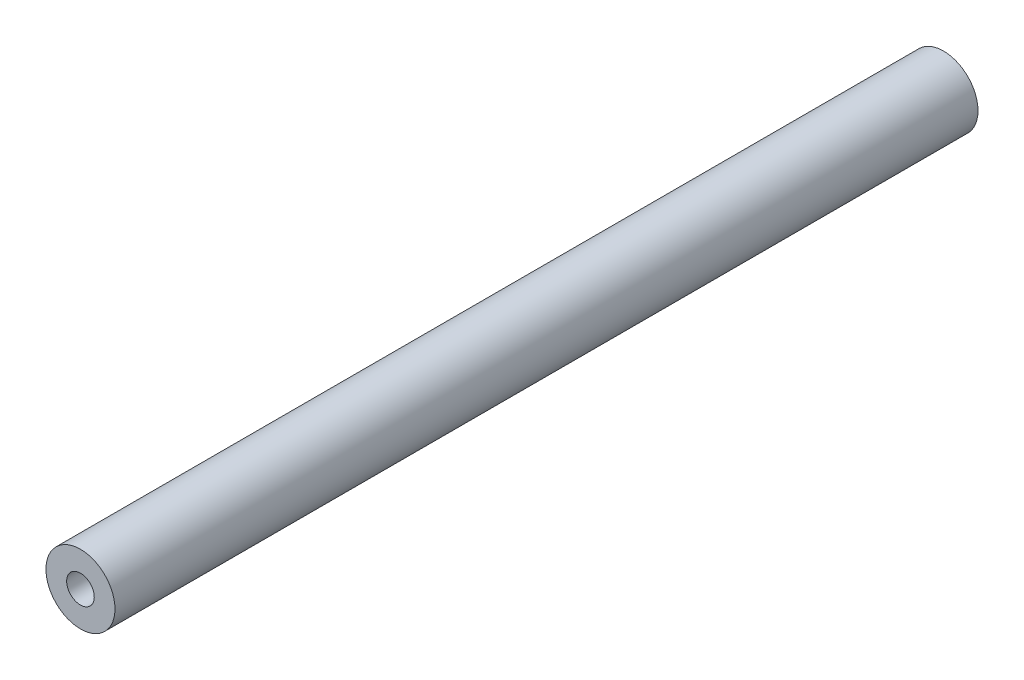
from build123d import *

# Parameters (mm, degrees)
SKETCH_1_R    = 4
SKETCH_1_R_2  = 1.6
F_130MM_DEPTH = 100


with BuildPart() as part:
    # 草图1 → 130mm铝柱 (new body)
    with BuildSketch(Plane.XY):
        Circle(SKETCH_1_R)
        Circle(SKETCH_1_R_2, mode=Mode.SUBTRACT)
    extrude(amount=F_130MM_DEPTH)


solid = part.part
